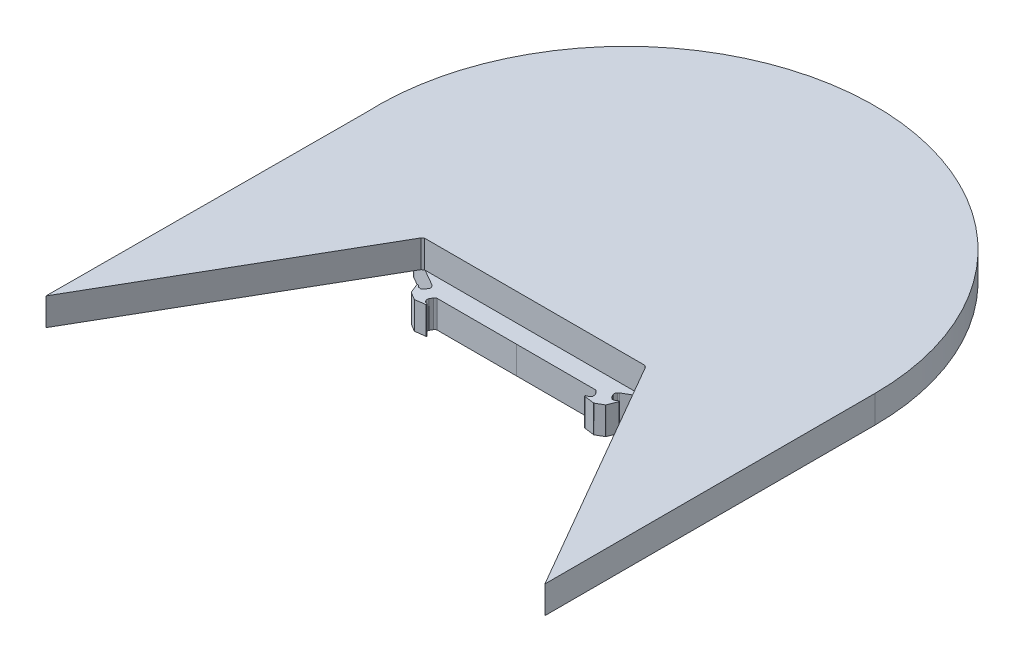
from build123d import *

# Parameters (mm, degrees)
BOSS_EXTRU_1_DEPTH = 5
BOSS_EXTRU_2_DEPTH = 5


with BuildPart() as part:
    # Esquisse1 → Boss.-Extru.1 (new body)
    with BuildSketch(Plane(origin=(0, 0, 0), x_dir=(1, 0, 0), z_dir=(0, 1, 0))):
        with BuildLine():
            Line((-45.607160176, -54.708924596), (-20.666600132, -11.510607431))
            Line((-20.666600132, -11.510607431), (-20.260750016, -11.207654407))
            Line((-20.260750016, -11.207654407), (-0.260750016, -11.207654407))
            Line((-0.260750016, -11.207654407), (19.739249984, -11.207654407))
            Line((19.739249984, -11.207654407), (20.085660146, -11.407654407))
            Line((20.085660146, -11.407654407), (45.085660146, -54.708924596))
            Line((45.085660146, -54.708924596), (45.085660146, 5.291075404))
            ThreePointArc((45.085660146, 5.291075404), (-1.258158233, 50.543971712), (-45.394459717, 3.135522912))
            Line((-45.394459717, 3.135522912), (-45.607160176, -54.708924596))
        make_face()
    extrude(amount=BOSS_EXTRU_1_DEPTH)

    # Esquisse3 → Boss.-Extru.2 (add)
    with BuildSketch(Plane.XZ):
        with BuildLine():
            Line((-17.273069059, 14.232839193), (-17.133250941, 13.990667109))
            Line((-17.133250941, 13.990667109), (-16.960798401, 13.691970548))
            ThreePointArc((-16.960798401, 13.691970548), (-16.911924508, 13.553212004), (-16.916519184, 13.406169561))
            Line((-16.916519184, 13.406169561), (-16.926742719, 13.359617338))
            ThreePointArc((-16.926742719, 13.359617338), (-16.954040192, 13.27824679), (-16.998068041, 13.204572733))
            Line((-16.998068041, 13.204572733), (-17.161029392, 12.988484086))
            ThreePointArc((-17.161029392, 12.988484086), (-17.215401514, 12.92969778), (-17.280393449, 12.882919517))
            Line((-17.280393449, 12.882919517), (-25.076017394, 8.382113933))
            ThreePointArc((-25.076017394, 8.382113933), (-25.541793777, 7.256712395), (-24.574863823, 6.516089195))
            Line((-24.574863823, 6.516089195), (23.930288039, 6.572043384))
            ThreePointArc((23.930288039, 6.572043384), (24.895209417, 7.313780849), (24.429134468, 8.438068122))
            Line((24.429134468, 8.438068122), (16.801950366, 12.841624917))
            ThreePointArc((16.801950366, 12.841624917), (16.690408296, 12.921554834), (16.596603028, 13.021709699))
            Line((16.596603028, 13.021709699), (16.578320724, 13.045535661))
            ThreePointArc((16.578320724, 13.045535661), (16.457519984, 13.29049533), (16.43965666, 13.563036996))
            Line((16.43965666, 13.563036996), (16.459154582, 13.711138423))
            ThreePointArc((16.459154582, 13.711138423), (16.463606056, 13.73022975), (16.471696528, 13.748085804))
            Line((16.471696528, 13.748085804), (16.751805291, 14.233248413))
            ThreePointArc((16.751805291, 14.233248413), (16.763223851, 14.249182995), (16.777531689, 14.262583747))
            Line((16.777531689, 14.262583747), (17.093212954, 14.504814501))
            ThreePointArc((17.093212954, 14.504814501), (17.128207192, 14.52207175), (17.167141716, 14.524623654))
            Line((17.167141716, 14.524623654), (17.553917324, 14.473703679))
            ThreePointArc((17.553917324, 14.473703679), (17.57989783, 14.466626641), (17.603048157, 14.452874058))
            Line((17.603048157, 14.452874058), (17.97191114, 14.159990026))
            ThreePointArc((17.97191114, 14.159990026), (18.094102127, 14.158310543), (18.126681115, 14.276090284))
            Line((18.126681115, 14.276090284), (17.433945609, 15.973517991))
            ThreePointArc((17.433945609, 15.973517991), (17.416714959, 16.001470658), (17.391359086, 16.02233514))
            Line((17.391359086, 16.02233514), (16.076159754, 16.781665828))
            ThreePointArc((16.076159754, 16.781665828), (16.045420057, 16.793190963), (16.012604566, 16.794140313))
            Line((16.012604566, 16.794140313), (14.195418018, 16.545522578))
            ThreePointArc((14.195418018, 16.545522578), (14.109691574, 16.458410399), (14.172267612, 16.353425666))
            Line((14.172267612, 16.353425666), (14.611112944, 16.18025755))
            ThreePointArc((14.611112944, 16.18025755), (14.63461266, 16.167083269), (14.653742684, 16.148113806))
            Line((14.653742684, 16.148113806), (14.891219551, 15.838627928))
            ThreePointArc((14.891219551, 15.838627928), (14.908476799, 15.80363369), (14.911028703, 15.764699166))
            Line((14.911028703, 15.764699166), (14.859091349, 15.370195794))
            ThreePointArc((14.859091349, 15.370195794), (14.854639876, 15.351104467), (14.846549403, 15.333248413))
            Line((14.846549403, 15.333248413), (14.56644064, 14.848085804))
            ThreePointArc((14.56644064, 14.848085804), (14.55502208, 14.832151222), (14.540714242, 14.81875047))
            Line((14.540714242, 14.81875047), (14.219073364, 14.571946743))
            ThreePointArc((14.219073364, 14.571946743), (14.190371735, 14.556599446), (14.158261785, 14.551282098))
            Line((14.158261785, 14.551282098), (-0.260750016, 14.541972588))
            Line((-0.260750016, 14.541972588), (-14.596285983, 14.541972588))
            ThreePointArc((-14.596285983, 14.541972588), (-14.667470827, 14.548357651), (-14.736383073, 14.567308998))
            Line((-14.736383073, 14.567308998), (-14.843485058, 14.607357396))
            ThreePointArc((-14.843485058, 14.607357396), (-14.96184332, 14.676732873), (-15.04979813, 14.782020985))
            Line((-15.04979813, 14.782020985), (-15.227995052, 15.090667109))
            Line((-15.227995052, 15.090667109), (-15.367372917, 15.332076652))
            ThreePointArc((-15.367372917, 15.332076652), (-15.375872662, 15.351164592), (-15.380220287, 15.371602138))
            Line((-15.380220287, 15.371602138), (-15.423614857, 15.783610378))
            ThreePointArc((-15.423614857, 15.783610378), (-15.420323499, 15.821535446), (-15.403097384, 15.855482533))
            Line((-15.403097384, 15.855482533), (-15.175198809, 16.148467569))
            ThreePointArc((-15.175198809, 16.148467569), (-15.156172757, 16.167140053), (-15.132889445, 16.180122335))
            Line((-15.132889445, 16.180122335), (-14.693034359, 16.353238171))
            ThreePointArc((-14.693034359, 16.353238171), (-14.630388491, 16.458360263), (-14.716399441, 16.54540781))
            Line((-14.716399441, 16.54540781), (-16.527659803, 16.78768329))
            ThreePointArc((-16.527659803, 16.78768329), (-16.561160911, 16.786495707), (-16.59238723, 16.774303432))
            Line((-16.59238723, 16.774303432), (-17.948561264, 15.96017176))
            ThreePointArc((-17.948561264, 15.96017176), (-17.973134754, 15.939376465), (-17.98982791, 15.911851216))
            Line((-17.98982791, 15.911851216), (-18.650555766, 14.274264265))
            ThreePointArc((-18.650555766, 14.274264265), (-18.617642424, 14.156714797), (-18.495586228, 14.158572299))
            Line((-18.495586228, 14.158572299), (-18.125279987, 14.452988106))
            ThreePointArc((-18.125279987, 14.452988106), (-18.101637875, 14.466966469), (-18.075084648, 14.473985744))
            Line((-18.075084648, 14.473985744), (-17.688740592, 14.520834995))
            ThreePointArc((-17.688740592, 14.520834995), (-17.650765358, 14.518139993), (-17.616549402, 14.501447188))
            Line((-17.616549402, 14.501447188), (-17.299518527, 14.262724159))
            ThreePointArc((-17.299518527, 14.262724159), (-17.284787821, 14.249114525), (-17.273069059, 14.232839193))
        make_face()
    extrude(amount=BOSS_EXTRU_2_DEPTH)


solid = part.part
